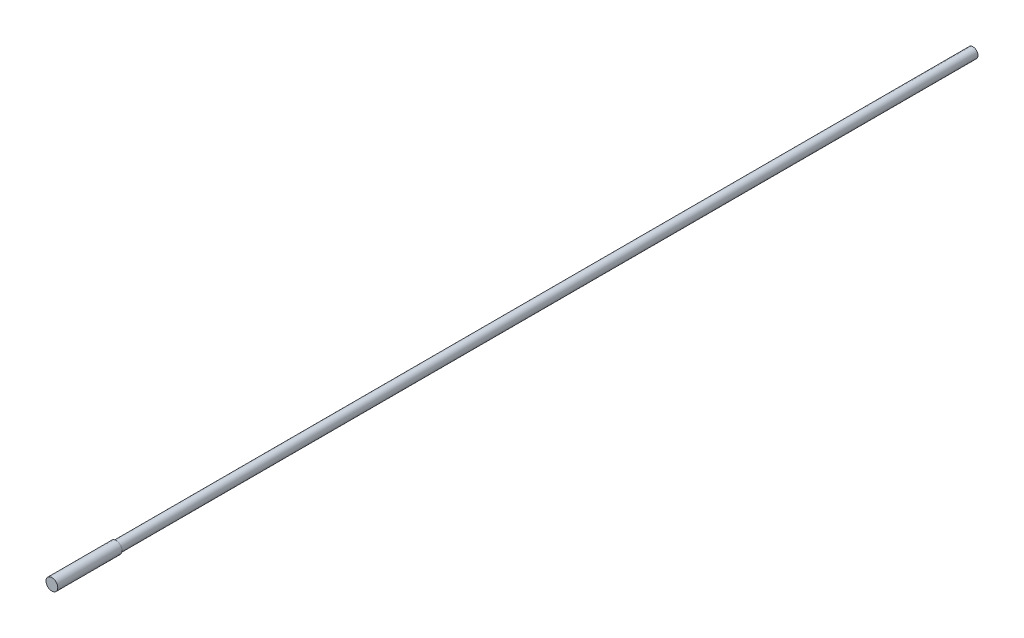
from build123d import *

# Parameters (mm, degrees)
SKETCH1_R           = 2.3495
SKETCH1_R_2         = 1.5625
BOSS_EXTRUDE1_DEPTH = 400.0000001
SKETCH2_R           = 2.75
BOSS_EXTRUDE2_DEPTH = 30


with BuildPart() as part:
    # Sketch1 → Boss-Extrude1 (new body)
    with BuildSketch(Plane.XY):
        with Locations(Location((0, 0, 0), (0, 0, 180))):
            Circle(SKETCH1_R)
        with Locations(Location((0, 0, 0), (0, 0, 180))):
            Circle(SKETCH1_R_2, mode=Mode.SUBTRACT)
    extrude(amount=BOSS_EXTRUDE1_DEPTH)

    # Sketch2 → Boss-Extrude2 (add)
    with BuildSketch(Plane.XY.offset(400.0000001)):
        Circle(SKETCH2_R)
    extrude(amount=BOSS_EXTRUDE2_DEPTH)


solid = part.part
